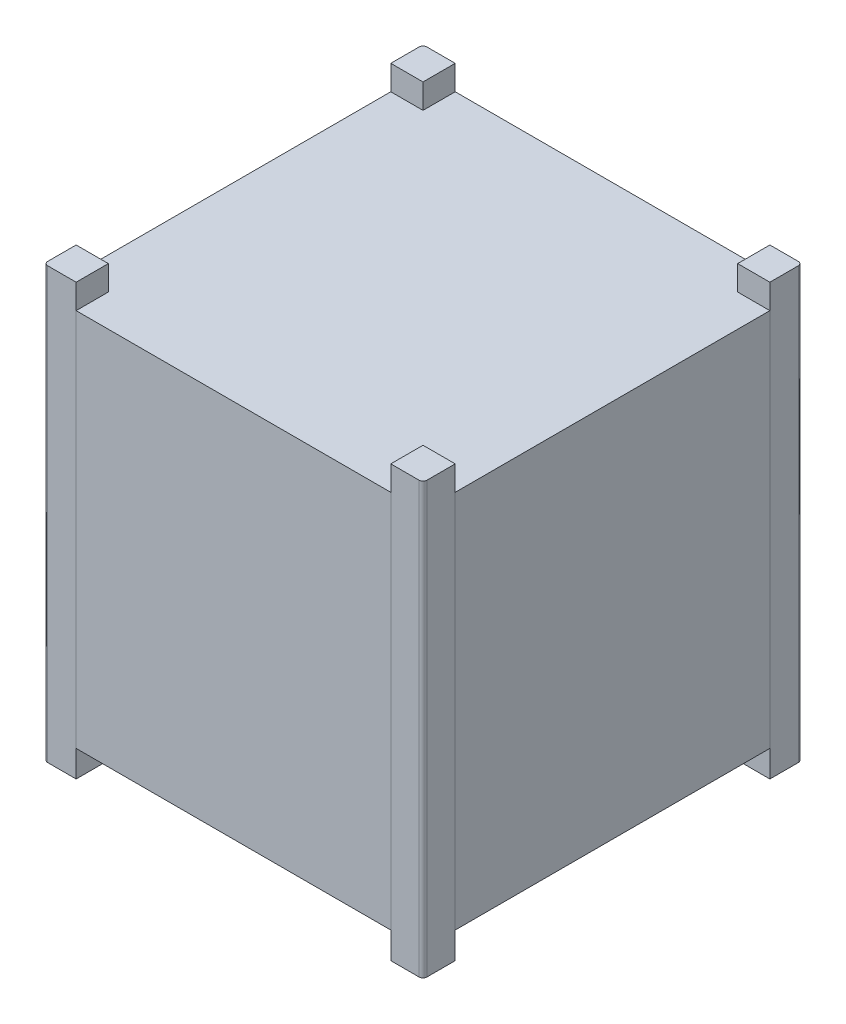
from build123d import *

# Parameters (mm, degrees)
SKETCH1_W           = 100
SKETCH1_H           = 100
BOSS_EXTRUDE1_DEPTH = 50
SKETCH2_W           = 8.5
SKETCH2_H           = 113.5
BOSS_EXTRUDE2_DEPTH = 8.5
FILLET1_R           = 1


with BuildPart() as part:
    # Sketch1 → Boss-Extrude1 (new, symmetric)
    with BuildSketch(Plane(origin=(0, 0, 0), x_dir=(1, 0, 0), z_dir=(0, 1, 0))):
        Rectangle(SKETCH1_W, SKETCH1_H)
    extrude(amount=BOSS_EXTRUDE1_DEPTH, both=True)

    # Sketch2 → Boss-Extrude2 (add)
    with BuildSketch(Plane(origin=(0, 0, 50), x_dir=(1, 0, 0), z_dir=(0, 0, -1))):
        with Locations((-45.75, 0.25)):
            Rectangle(SKETCH2_W, SKETCH2_H)
        with Locations((45.75, 0.25)):
            Rectangle(SKETCH2_W, SKETCH2_H)
    boss_extrude2 = extrude(amount=BOSS_EXTRUDE2_DEPTH)

    # Mirror1: Boss-Extrude2 across plane
    add(boss_extrude2.mirror(Plane.XY))

    # Fillet1
    fillet1_edges = [part.edges().sort_by_distance(p)[0] for p in [
        (50, -0.25, 50),
        (-50, -0.25, 50),
        (-50, -0.25, -50),
        (50, -0.25, -50),
    ]]
    fillet(fillet1_edges, radius=FILLET1_R)


solid = part.part
